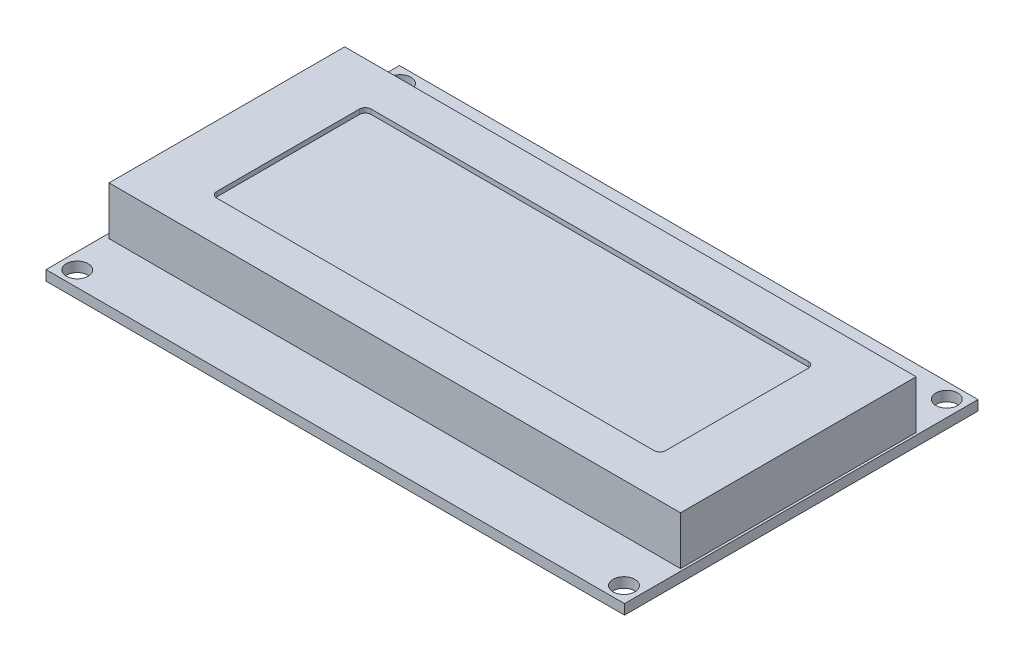
from build123d import *

# Parameters (mm, degrees)
SKETCH_1_W          = 98.2
SKETCH_1_H          = 60
SKETCH_1_R          = 1.85
EXTRUDE_1_DEPTH     = 1.7
SKETCH_2_W          = 97
SKETCH_2_H          = 40
EXTRUDE_2_DEPTH     = 9.9
CUT_EXTRUDE_1_DEPTH = 0.8
EXTRUDE_START       = -2.7
SKETCH_4_W          = 42
SKETCH_4_H          = 19.6
EXTRUDE_3_DEPTH     = 1.5
SKETCH_5_W          = 40.7
SKETCH_5_H          = 2.6
EXTRUDE_4_DEPTH     = 2.7
SKETCH_6_W          = 7
SKETCH_6_H          = 7
EXTRUDE_5_DEPTH     = 5
SKETCH_6_3_W        = 7.5
SKETCH_6_3_H        = 10.5
EXTRUDE_6_DEPTH     = 2.2


with BuildPart() as part:
    # 草圖1 → 填料-伸長1 (new body)
    with BuildSketch(Plane(origin=(0, 0, 0), x_dir=(1, 0, 0), z_dir=(0, 1, 0))):
        Rectangle(SKETCH_1_W, SKETCH_1_H)
        with Locations(Location((46.4, 27.4, 0), (0, 0, 270))):
            Circle(SKETCH_1_R, mode=Mode.SUBTRACT)
        with Locations(Location((-46.4, 27.4, 0), (0, 0, 90))):
            Circle(SKETCH_1_R, mode=Mode.SUBTRACT)
        with Locations(Location((46.4, -27.4, 0), (0, 0, 90))):
            Circle(SKETCH_1_R, mode=Mode.SUBTRACT)
        with Locations(Location((-46.4, -27.4, 0), (0, 0, 270))):
            Circle(SKETCH_1_R, mode=Mode.SUBTRACT)
    extrude(amount=EXTRUDE_1_DEPTH)

    # 草圖2 → 填料-伸長2 (add)
    with BuildSketch(Plane(origin=(0, 0, 0), x_dir=(1, 0, 0), z_dir=(0, 1, 0))):
        with Locations((0.2, -0.1)):
            Rectangle(SKETCH_2_W, SKETCH_2_H)
    extrude(amount=EXTRUDE_2_DEPTH)

    # 草圖3 → 除料-伸長1 (cut)
    with BuildSketch(Plane(origin=(0, 9.9, 0), x_dir=(1, 0, 0), z_dir=(0, 1, 0))):
        with BuildLine():
            Line((-36.9, -13.2), (37.3, -13.2))
            ThreePointArc((37.3, -13.2), (38.007106781, -12.907106781), (38.3, -12.2))
            Line((38.3, -12.2), (38.3, 12))
            ThreePointArc((38.3, 12), (38.007106781, 12.707106781), (37.3, 13))
            Line((37.3, 13), (-36.9, 13))
            ThreePointArc((-36.9, 13), (-37.607106781, 12.707106781), (-37.9, 12))
            Line((-37.9, 12), (-37.9, -12.2))
            ThreePointArc((-37.9, -12.2), (-37.607106781, -12.907106781), (-36.9, -13.2))
        make_face()
    extrude(amount=-CUT_EXTRUDE_1_DEPTH, mode=Mode.SUBTRACT)



with BuildPart() as body_2:
    # 草圖4 → 填料-伸長3 (new body)
    with BuildSketch(Plane(origin=(0, 0, 0), x_dir=(1, 0, 0), z_dir=(0, 1, 0)).offset(EXTRUDE_START)):
        with Locations((-20.3, 19.1)):
            Rectangle(SKETCH_4_W, SKETCH_4_H)
    extrude(amount=-EXTRUDE_3_DEPTH)


with BuildPart() as part_1:
    add(part.part)

    add(body_2.part)  # 填料-伸長4 merges body 2
    # 草圖5 → 填料-伸長4 (add)
    with BuildSketch(Plane(origin=(0, 0, 0), x_dir=(1, 0, 0), z_dir=(0, 1, 0))):
        with Locations((-19.95, 27.6)):
            Rectangle(SKETCH_5_W, SKETCH_5_H)
    extrude(amount=-EXTRUDE_4_DEPTH)

    # 草圖6 → 填料-伸長5 (add)
    with BuildSketch(Plane.XZ.offset(4.2)):
        with Locations((-30, -21.2)):
            Rectangle(SKETCH_6_W, SKETCH_6_H)
    extrude(amount=EXTRUDE_5_DEPTH)

    # 草圖6<3> → 填料-伸長6 (add)
    with BuildSketch(Plane.XZ.offset(4.2)):
        with Locations((-19.15, -20.45)):
            Rectangle(SKETCH_6_3_W, SKETCH_6_3_H)
    extrude(amount=EXTRUDE_6_DEPTH)


solid = part_1.part
